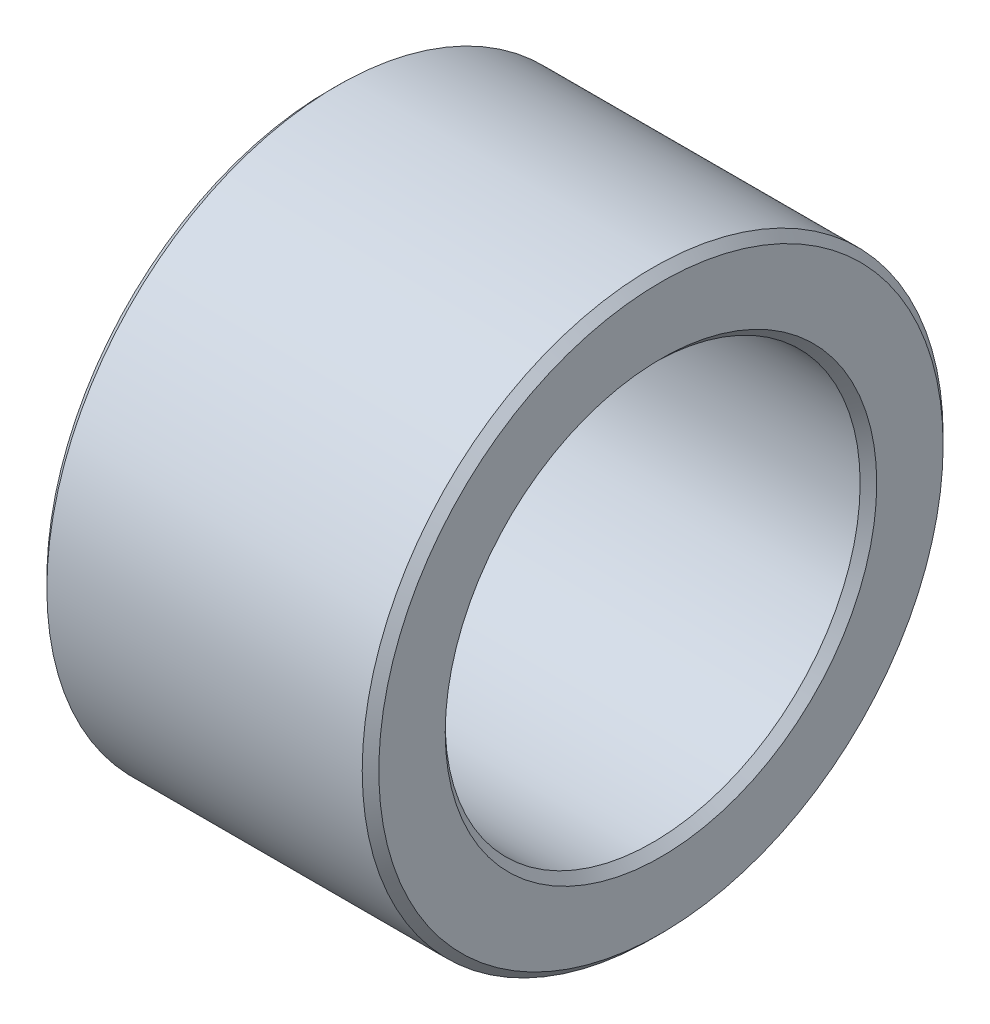
from build123d import *

# Parameters (mm, degrees)
SKETCH_1_R      = 3.5
SKETCH_1_R_2    = 2.5
EXTRUDE_1_DEPTH = 4
CHAMFER_1_SIZE  = 0.1


with BuildPart() as part:
    # 草图1 → 凸台-拉伸1 (new body)
    with BuildSketch(Plane.YZ):
        with Locations(Location((0, 0, 0), (0, 0, 270))):
            Circle(SKETCH_1_R)
        with Locations(Location((0, 0, 0), (0, 0, 270))):
            Circle(SKETCH_1_R_2, mode=Mode.SUBTRACT)
    extrude(amount=EXTRUDE_1_DEPTH)

    # 倒角1
    chamfer_1_edges = [part.edges().sort_by_distance(p)[0] for p in [
        (0, 0, 3.5),
        (4, 0, 3.5),
        (0, 0, 2.5),
        (4, 0, 2.5),
    ]]
    chamfer(chamfer_1_edges, length=CHAMFER_1_SIZE)


solid = part.part
